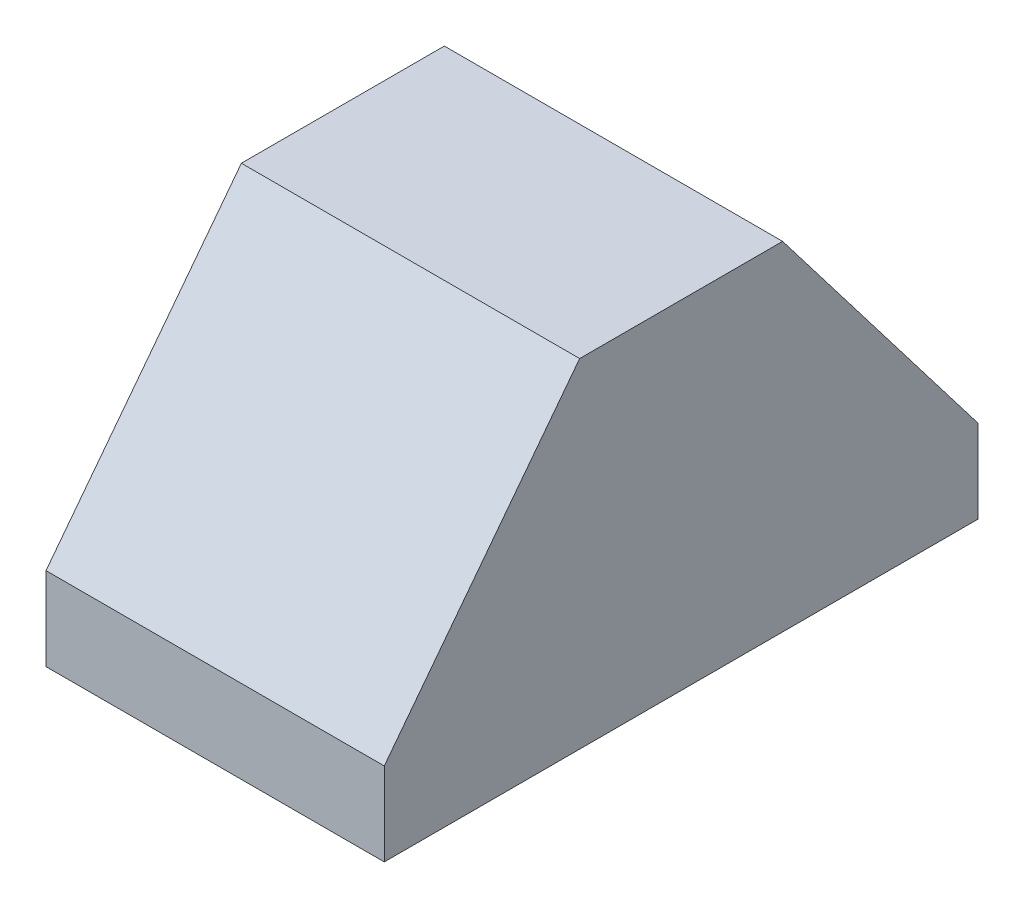
from build123d import *

# Parameters (mm, degrees)
BOSS_EXTRUDE1_DEPTH = 50


with BuildPart() as part:
    # Sketch2 → Boss-Extrude1 (new body)
    with BuildSketch(Plane(origin=(0, 0, 0), x_dir=(0, 0, -1), z_dir=(1, 0, 0))):
        Polygon((0, 0), (87.758653411, 0), (87.758653411, 12.289828899), (58.879326705, 50), (28.879326705, 50), (0, 12.289828899), align=None)
    extrude(amount=BOSS_EXTRUDE1_DEPTH)


solid = part.part
